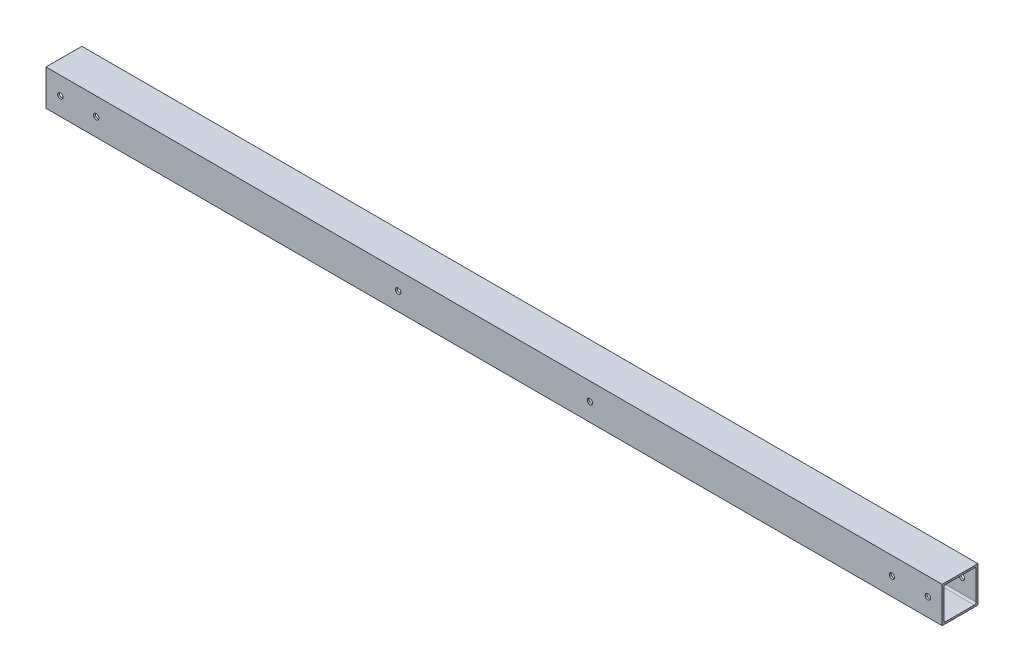
from build123d import *

# Parameters (mm, degrees)
SKETCH1_W           = 20
SKETCH1_H           = 20
BOSS_EXTRUDE1_DEPTH = 500
SKETCH2_R           = 1.5
CUT_EXTRUDE1_DEPTH  = 600
SKETCH3_R           = 1.5
CUT_EXTRUDE2_DEPTH  = 30
SKETCH4_R           = 1.5
CUT_EXTRUDE3_DEPTH  = 20


with BuildPart() as part:
    # Sketch1 → Boss-Extrude1 (new body)
    with BuildSketch(Plane(origin=(0, 0, 0), x_dir=(0, 0, -1), z_dir=(1, 0, 0))):
        Rectangle(SKETCH1_W, SKETCH1_H)
        with BuildLine():
            Line((-8, -9), (8, -9))
            ThreePointArc((8, -9), (8.707106781, -8.707106781), (9, -8))
            Line((9, -8), (9, 8))
            ThreePointArc((9, 8), (8.707106781, 8.707106781), (8, 9))
            Line((8, 9), (-8, 9))
            ThreePointArc((-8, 9), (-8.707106781, 8.707106781), (-9, 8))
            Line((-9, 8), (-9, -8))
            ThreePointArc((-9, -8), (-8.707106781, -8.707106781), (-8, -9))
        make_face(mode=Mode.SUBTRACT)
    extrude(amount=BOSS_EXTRUDE1_DEPTH)

    # Sketch2 → Cut-Extrude1 (cut)
    with BuildSketch(Plane.XY.offset(10)):
        with Locations((8, 0)):
            Circle(SKETCH2_R)
        with Locations((28, 0)):
            Circle(SKETCH2_R)
    extrude(amount=-CUT_EXTRUDE1_DEPTH, mode=Mode.SUBTRACT)

    # Sketch3 → Cut-Extrude2 (cut)
    with BuildSketch(Plane.XY.offset(10)):
        with Locations((492, 0)):
            Circle(SKETCH3_R)
        with Locations((472, 0)):
            Circle(SKETCH3_R)
    extrude(amount=-CUT_EXTRUDE2_DEPTH, mode=Mode.SUBTRACT)

    # Sketch4 → Cut-Extrude3 (cut)
    with BuildSketch(Plane.XY.offset(10)):
        with Locations((196.5, 0)):
            Circle(SKETCH4_R)
        with Locations((303.5, 0)):
            Circle(SKETCH4_R)
    extrude(amount=-CUT_EXTRUDE3_DEPTH, mode=Mode.SUBTRACT)


solid = part.part
